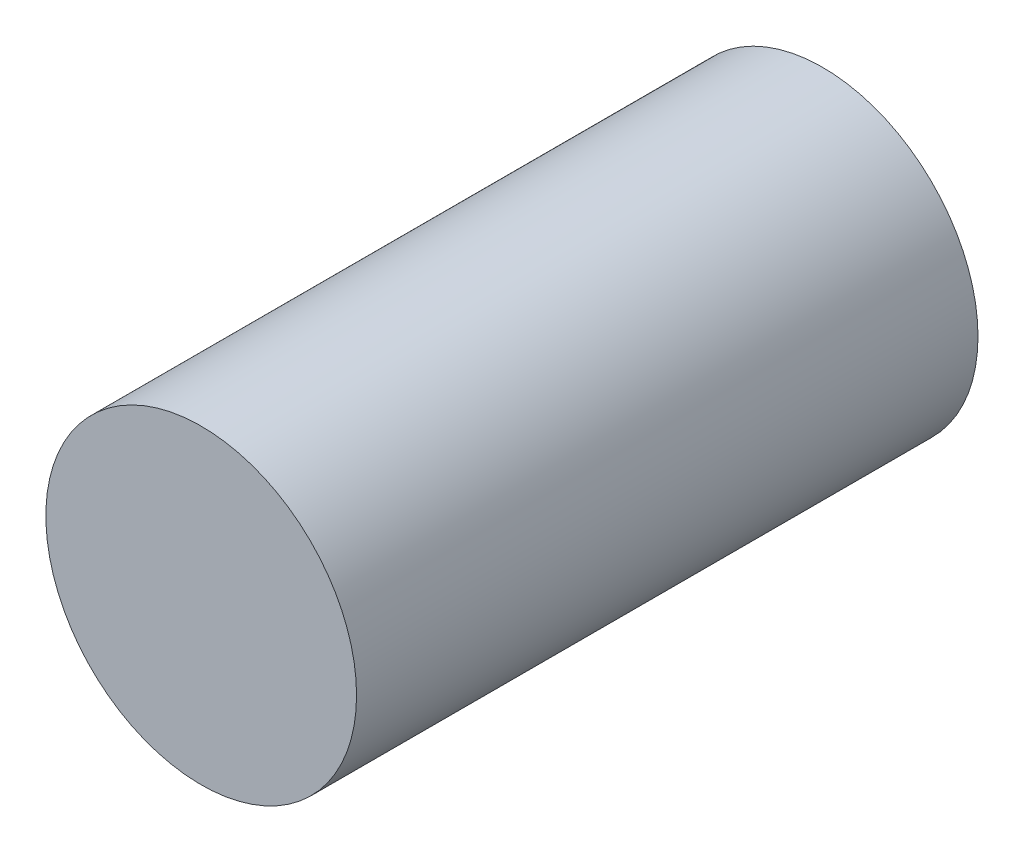
from build123d import *

# Parameters (mm, degrees)
SKETCH1_R           = 25
BOSS_EXTRUDE1_DEPTH = 100


with BuildPart() as part:
    # Sketch1 → Boss-Extrude1 (new body)
    with BuildSketch(Plane.XY):
        with Locations((-66.547347631, -10.924211099)):
            Circle(SKETCH1_R)
    extrude(amount=BOSS_EXTRUDE1_DEPTH)


solid = part.part
